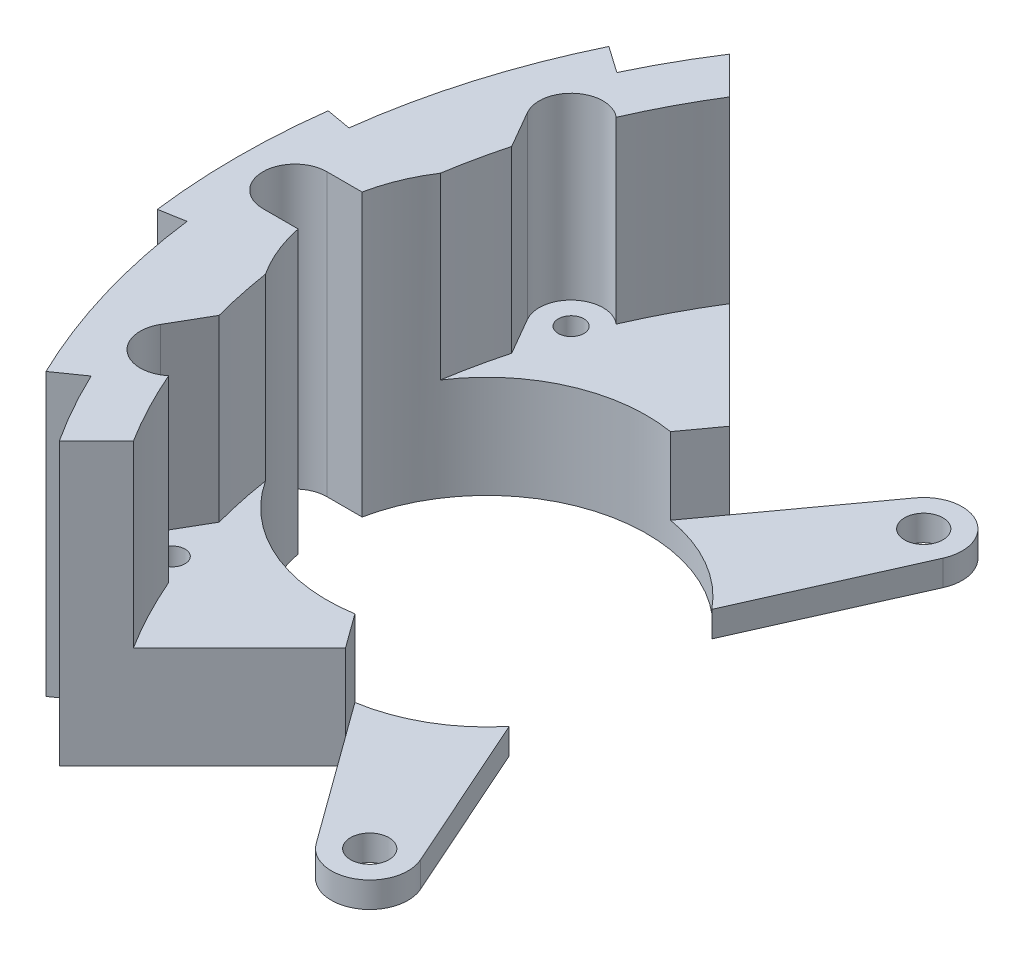
from build123d import *

# Parameters (mm, degrees)
SKETCH2_R           = 1
BOSS_EXTRUDE1_DEPTH = 8
SKETCH2_5_R         = 1.5
BOSS_EXTRUDE9_DEPTH = 2
SKETCH2_4_R         = 1.5
BOSS_EXTRUDE6_DEPTH = 2
BOSS_EXTRUDE7_DEPTH = 14
SKETCH7_R           = 44
CUT_EXTRUDE2_DEPTH  = 14


with BuildPart() as part:
    # Sketch2 → Boss-Extrude1 (new body)
    with BuildSketch(Plane(origin=(0, 0, 0), x_dir=(1, 0, 0), z_dir=(0, 1, 0))):
        with BuildLine():
            Line((-15, 2.5), (-12.247448714, 2.5))
            ThreePointArc((-12.247448714, 2.5), (-7.093218404, 10.292533831), (2.023666108, 12.335103384))
            Line((2.023666108, 12.335103384), (3.959826833, 15))
            Line((3.959826833, 15), (-7.227290386, 26.187117219))
            ThreePointArc((-7.227290386, 26.187117219), (-8.899257061, 23.419057575), (-10.381047178, 20.54470116))
            Line((-10.381047178, 20.54470116), (-12.456884927, 21.9982184))
            ThreePointArc((-12.456884927, 21.9982184), (-15.417724422, 14.351792983), (-17.102086602, 6.32699914))
            Line((-17.102086602, 6.32699914), (-19.074188035, 6.67300086))
            ThreePointArc((-19.074188035, 6.67300086), (-19.5, 0), (-19.074188035, -6.67300086))
            Line((-19.074188035, -6.67300086), (-17.102086602, -6.32699914))
            ThreePointArc((-17.102086602, -6.32699914), (-15.417724422, -14.351792983), (-12.456884927, -21.9982184))
            Line((-12.456884927, -21.9982184), (-10.381047178, -20.54470116))
            ThreePointArc((-10.381047178, -20.54470116), (-8.899257061, -23.419057575), (-7.227290386, -26.187117219))
            Line((-7.227290386, -26.187117219), (3.959826833, -15))
            Line((3.959826833, -15), (2.023666108, -12.335103384))
            ThreePointArc((2.023666108, -12.335103384), (-7.093218404, -10.292533831), (-12.247448714, -2.5))
            Line((-12.247448714, -2.5), (-15, -2.5))
            ThreePointArc((-15, -2.5), (-17.5, 0), (-15, 2.5))
        make_face()
        with Locations((-9, 15.588457268)):
            Circle(SKETCH2_R, mode=Mode.SUBTRACT)
        with Locations((-9, -15.588457268)):
            Circle(SKETCH2_R, mode=Mode.SUBTRACT)
    extrude(amount=BOSS_EXTRUDE1_DEPTH)

    # Sketch2<5> → Boss-Extrude9 (add)
    # profile 1 of 2: a face of its own
    with BuildSketch(Plane(origin=(0, 0, 0), x_dir=(1, 0, 0), z_dir=(0, 1, 0))):
        with BuildLine():
            Line((10.072949017, 23.413990851), (2.023666108, 12.335103384))
            ThreePointArc((2.023666108, 12.335103384), (6.25, 10.825317547), (9.670679834, 7.92009795))
            Line((9.670679834, 7.92009795), (15.240636373, 20.430425165))
            ThreePointArc((15.240636373, 20.430425165), (14, 24.248711306), (10.072949017, 23.413990851))
        make_face()
        with Locations((12.5, 21.650635095)):
            Circle(SKETCH2_5_R, mode=Mode.SUBTRACT)
    # profile 2 of 2: a face of its own
    with BuildSketch(Plane(origin=(0, 0, 0), x_dir=(1, 0, 0), z_dir=(0, 1, 0))):
        with BuildLine():
            Line((15.240636373, -20.430425165), (9.670679834, -7.92009795))
            ThreePointArc((9.670679834, -7.92009795), (6.25, -10.825317547), (2.023666108, -12.335103384))
            Line((2.023666108, -12.335103384), (10.072949017, -23.413990851))
            ThreePointArc((10.072949017, -23.413990851), (14, -24.248711306), (15.240636373, -20.430425165))
        make_face()
        with Locations((12.5, -21.650635095)):
            Circle(SKETCH2_5_R, mode=Mode.SUBTRACT)
    extrude(amount=BOSS_EXTRUDE9_DEPTH)

    # Sketch2<4> → Boss-Extrude6 (add)
    # profile 1 of 2: a face of its own
    with BuildSketch(Plane(origin=(0, 0, 0), x_dir=(1, 0, 0), z_dir=(0, 1, 0))):
        with BuildLine():
            Line((10.072949017, 23.413990851), (2.023666108, 12.335103384))
            ThreePointArc((2.023666108, 12.335103384), (6.25, 10.825317547), (9.670679834, 7.92009795))
            Line((9.670679834, 7.92009795), (15.240636373, 20.430425165))
            ThreePointArc((15.240636373, 20.430425165), (14, 24.248711306), (10.072949017, 23.413990851))
        make_face()
        with Locations((12.5, 21.650635095)):
            Circle(SKETCH2_4_R, mode=Mode.SUBTRACT)
    # profile 2 of 2: a face of its own
    with BuildSketch(Plane(origin=(0, 0, 0), x_dir=(1, 0, 0), z_dir=(0, 1, 0))):
        with BuildLine():
            Line((15.240636373, -20.430425165), (9.670679834, -7.92009795))
            ThreePointArc((9.670679834, -7.92009795), (6.25, -10.825317547), (2.023666108, -12.335103384))
            Line((2.023666108, -12.335103384), (10.072949017, -23.413990851))
            ThreePointArc((10.072949017, -23.413990851), (14, -24.248711306), (15.240636373, -20.430425165))
        make_face()
        with Locations((12.5, -21.650635095)):
            Circle(SKETCH2_4_R, mode=Mode.SUBTRACT)
    extrude(amount=BOSS_EXTRUDE6_DEPTH)

    # Sketch5 → Boss-Extrude7 (add)
    with BuildSketch(Plane(origin=(0, 8, 0), x_dir=(1, 0, 0), z_dir=(0, 1, 0))):
        with BuildLine():
            Line((-15, 2.5), (-12.247448714, 2.5))
            ThreePointArc((-12.247448714, 2.5), (-10.825317547, 6.25), (-8.288787866, 9.356601718))
            Line((-8.288787866, 9.356601718), (-11.165063509, 14.338457268))
            ThreePointArc((-11.165063509, 14.338457268), (-10.25, 17.753520778), (-6.834936491, 16.838457268))
            Line((-6.834936491, 16.838457268), (-3.958660847, 11.856601718))
            ThreePointArc((-3.958660847, 11.856601718), (-0.996640417, 12.460204969), (2.023666108, 12.335103384))
            Line((2.023666108, 12.335103384), (3.959826833, 15))
            Line((3.959826833, 15), (-7.227290386, 26.187117219))
            ThreePointArc((-7.227290386, 26.187117219), (-8.899257061, 23.419057575), (-10.381047178, 20.54470116))
            Line((-10.381047178, 20.54470116), (-12.456884927, 21.9982184))
            ThreePointArc((-12.456884927, 21.9982184), (-15.417724422, 14.351792983), (-17.102086602, 6.32699914))
            Line((-17.102086602, 6.32699914), (-19.074188035, 6.67300086))
            ThreePointArc((-19.074188035, 6.67300086), (-19.5, 0), (-19.074188035, -6.67300086))
            Line((-19.074188035, -6.67300086), (-17.102086602, -6.32699914))
            ThreePointArc((-17.102086602, -6.32699914), (-15.417724422, -14.351792983), (-12.456884927, -21.9982184))
            Line((-12.456884927, -21.9982184), (-10.381047178, -20.54470116))
            ThreePointArc((-10.381047178, -20.54470116), (-8.899257061, -23.419057575), (-7.227290386, -26.187117219))
            Line((-7.227290386, -26.187117219), (3.959826833, -15))
            Line((3.959826833, -15), (2.023666108, -12.335103384))
            ThreePointArc((2.023666108, -12.335103384), (-0.996640417, -12.460204969), (-3.958660847, -11.856601718))
            Line((-3.958660847, -11.856601718), (-6.834936491, -16.838457268))
            ThreePointArc((-6.834936491, -16.838457268), (-10.25, -17.753520778), (-11.165063509, -14.338457268))
            Line((-11.165063509, -14.338457268), (-8.288787866, -9.356601718))
            ThreePointArc((-8.288787866, -9.356601718), (-10.825317547, -6.25), (-12.247448714, -2.5))
            Line((-12.247448714, -2.5), (-15, -2.5))
            ThreePointArc((-15, -2.5), (-17.5, 0), (-15, 2.5))
        make_face()
    extrude(amount=BOSS_EXTRUDE7_DEPTH)

    # Sketch7 → Cut-Extrude2 (cut)
    with BuildSketch(Plane(origin=(0, 22, 0), x_dir=(1, 0, 0), z_dir=(0, 1, 0))):
        with Locations((33, 0)):
            Circle(SKETCH7_R)
    extrude(amount=-CUT_EXTRUDE2_DEPTH, mode=Mode.SUBTRACT)


solid = part.part
